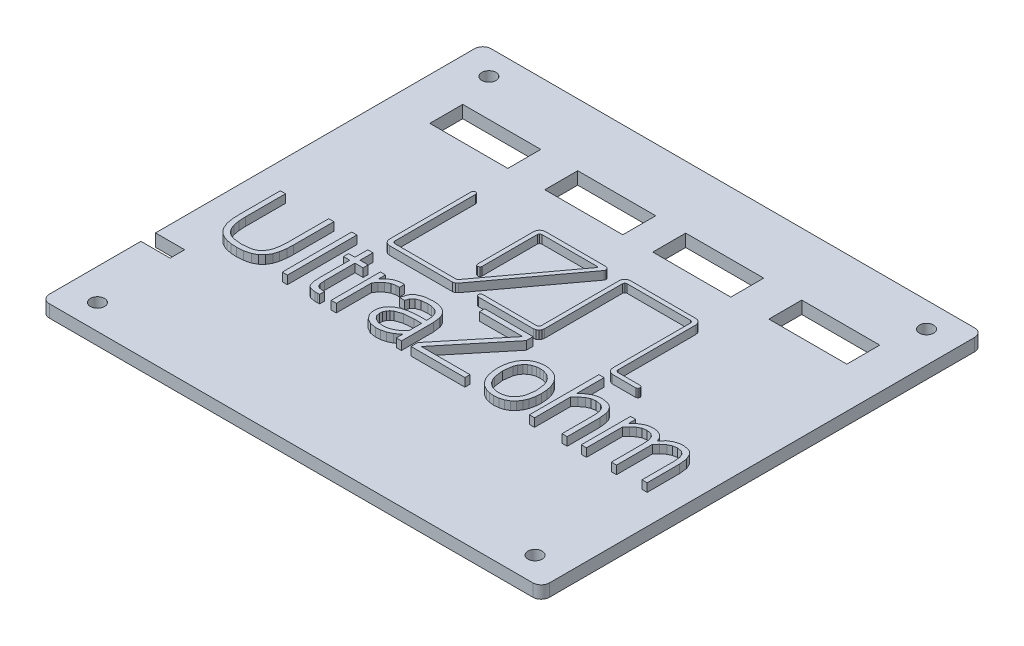
from build123d import *

# Parameters (mm, degrees)
AUFSATZ_LINEAR_AUSTRAGEN1_DEPTH = 3
SKIZZE2_R                       = 1.7
SCHNITT_LINEAR_AUSTRAGEN1_DEPTH = 3
SKIZZE3_W                       = 18.72
SKIZZE3_H                       = 7.9
SCHNITT_LINEAR_AUSTRAGEN2_DEPTH = 3
LINEARES_MUSTER1_COUNT          = 2
LINEARES_MUSTER1_PITCH          = 27.85
LINEARES_MUSTER2_COUNT          = 2
LINEARES_MUSTER2_PITCH          = 53.76
LINEARES_MUSTER3_COUNT          = 2
LINEARES_MUSTER3_PITCH          = 81.35
SKIZZE4_W                       = 7
SKIZZE4_H                       = 3.5
SCHNITT_LINEAR_AUSTRAGEN3_DEPTH = 3
SKIZZE9_W                       = 1.236063568
SKIZZE9_H                       = 16.679437304
AUFSATZ_LINEAR_AUSTRAGEN2_DEPTH = 2


with BuildPart() as part:
    # Skizze1 → Aufsatz-Linear austragen1 (new body)
    with BuildSketch(Plane(origin=(0, 0, 0), x_dir=(1, 0, 0), z_dir=(0, 1, 0))):
        with BuildLine():
            Line((-58, -53), (58, -53))
            ThreePointArc((58, -53), (59.414213562, -52.414213562), (60, -51))
            Line((60, -51), (60, 51))
            ThreePointArc((60, 51), (59.414213562, 52.414213562), (58, 53))
            Line((58, 53), (-58, 53))
            ThreePointArc((-58, 53), (-59.414213562, 52.414213562), (-60, 51))
            Line((-60, 51), (-60, -51))
            ThreePointArc((-60, -51), (-59.414213562, -52.414213562), (-58, -53))
        make_face()
    extrude(amount=AUFSATZ_LINEAR_AUSTRAGEN1_DEPTH)

    # Skizze2 → Schnitt-Linear austragen1 (cut)
    with BuildSketch(Plane(origin=(0, 3, 0), x_dir=(1, 0, 0), z_dir=(0, 1, 0))):
        with Locations(Location((-52.5, 46.97, 0), (0, 0, 270))):
            Circle(SKIZZE2_R)
        with Locations(Location((52.5, 46.97, 0), (0, 0, 270))):
            Circle(SKIZZE2_R)
        with Locations(Location((52.5, -46.97, 0), (0, 0, 270))):
            Circle(SKIZZE2_R)
        with Locations(Location((-52.5, -46.97, 0), (0, 0, 270))):
            Circle(SKIZZE2_R)
    extrude(amount=-SCHNITT_LINEAR_AUSTRAGEN1_DEPTH, mode=Mode.SUBTRACT)

    # Skizze3 → Schnitt-Linear austragen2 (cut)
    with BuildSketch(Plane(origin=(0, 3, 0), x_dir=(1, 0, 0), z_dir=(0, 1, 0))):
        with Locations((40.86, 34.08)):
            Rectangle(SKIZZE3_W, SKIZZE3_H)
    schnitt_linear_austragen2 = extrude(amount=-SCHNITT_LINEAR_AUSTRAGEN2_DEPTH, mode=Mode.SUBTRACT)

    # Lineares Muster1: Schnitt-Linear austragen2 ×2
    with Locations(*[(-i * LINEARES_MUSTER1_PITCH, 0, 0) for i in range(1, LINEARES_MUSTER1_COUNT)]):
        add(schnitt_linear_austragen2, mode=Mode.SUBTRACT)

    # Lineares Muster2: Schnitt-Linear austragen2 ×2
    with Locations(*[(-i * LINEARES_MUSTER2_PITCH, 0, 0) for i in range(1, LINEARES_MUSTER2_COUNT)]):
        add(schnitt_linear_austragen2, mode=Mode.SUBTRACT)

    # Lineares Muster3: Schnitt-Linear austragen2 ×2
    with Locations(*[(-i * LINEARES_MUSTER3_PITCH, 0, 0) for i in range(1, LINEARES_MUSTER3_COUNT)]):
        add(schnitt_linear_austragen2, mode=Mode.SUBTRACT)

    # Skizze4 → Schnitt-Linear austragen3 (cut)
    with BuildSketch(Plane(origin=(0, 3, 0), x_dir=(1, 0, 0), z_dir=(0, 1, 0))):
        with Locations((-56.5, -27.3)):
            Rectangle(SKIZZE4_W, SKIZZE4_H)
    extrude(amount=-SCHNITT_LINEAR_AUSTRAGEN3_DEPTH, mode=Mode.SUBTRACT)

    # Skizze9 → Aufsatz-Linear austragen2 (add)
    # profile 1 of 11: a face of its own
    with BuildSketch(Plane(origin=(0, 3, 0), x_dir=(1, 0, 0), z_dir=(0, 1, 0))):
        Polygon((-12.148241554, -2.128756598), (-27.28013001, -2.128756598), (-27.810505378, -2.020807614), (-28.243459554, -1.728197582), (-28.535284218, -1.294713054), (-28.64227105, -0.764142614), (-28.64227105, 18.884317962), (-28.49021649, 19.251409938), (-28.123124514, 19.403464498), (-27.75762969, 19.25053821), (-27.606450922, 18.884317962), (-27.606450922, -0.561428262), (-27.454248026, -0.927649526), (-27.087304386, -1.07810287), (-12.148241554, -1.07810287), (-12.039473674, -1.02123735), (2.190088926, 18.261346386), (2.202390654, 18.404853338), (2.078845054, 18.478894338), (-11.337387194, 18.478894338), (-11.704482218, 18.326840794), (-11.856537794, 17.959747802), (-11.856537794, 4.639930906), (-12.006989106, 4.272990314), (-12.373204274, 4.12078437), (-12.740299298, 4.272837914), (-12.892354874, 4.639930906), (-12.892354874, 18.142684698), (-12.785311146, 18.672890394), (-12.493394026, 19.105861842), (-12.060423594, 19.397780994), (-11.530217898, 19.504825738), (3.055331798, 19.504825738), (3.426465422, 19.41852365), (3.688681814, 19.142061922), (3.755248102, 18.76688665), (3.604148582, 18.417091058), (-11.211305658, -1.634326294), (-11.624119666, -1.987003262), align=None)
    # profile 2 of 11: a face of its own
    with BuildSketch(Plane(origin=(0, 3, 0), x_dir=(1, 0, 0), z_dir=(0, 1, 0))):
        Polygon((31.82841319, -2.128756598), (26.28096175, -2.128756598), (25.750586382, -2.020807614), (25.317632206, -1.728197582), (25.025807542, -1.294713054), (24.91882071, -0.764142614), (24.91882071, 17.952325922), (24.767640926, 18.318547186), (24.40214407, 18.471472458), (9.10957623, 18.471472458), (8.744079374, 18.318547186), (8.59289959, 17.952325922), (8.59289959, -0.751781958), (8.493061334, -1.276651622), (8.199350974, -1.722959086), (7.75679255, -2.022288942), (7.23322743, -2.128756598), (-5.960509962, -2.128756598), (-6.327604986, -1.976703054), (-6.479660562, -1.609610062), (-6.327604986, -1.24251707), (-5.960509962, -1.090463526), (7.03793191, -1.090463526), (7.404867422, -0.940006118), (7.55706727, -0.573788918), (7.55706727, 18.142679618), (7.66075515, 18.66395061), (7.956033198, 19.105861842), (8.397946462, 19.401136842), (8.91921847, 19.504820658), (24.59249167, 19.504820658), (25.113763678, 19.401136842), (25.555676942, 19.105861842), (25.85095499, 18.66395061), (25.95464287, 18.142679618), (25.95464287, -0.56390019), (26.106845766, -0.930120438), (26.47378839, -1.080574798), (31.82841319, -1.080574798), (32.193902934, -1.233503118), (32.34507967, -1.599721334), (32.197435566, -1.97234035), align=None)
    # profile 3 of 11: a face of its own
    with BuildSketch(Plane(origin=(0, 3, 0), x_dir=(1, 0, 0), z_dir=(0, 1, 0))):
        Polygon((-45.35384545, -20.793310582), (-46.65029701, -20.727910662), (-47.924857834, -20.481822254), (-48.850712218, -20.139625326), (-49.699843362, -19.636354806), (-50.322953114, -19.06881111), (-50.81971717, -18.387931598), (-51.45010961, -16.86510203), (-51.719571098, -15.188999718), (-51.773957578, -13.498065838), (-51.773957578, -3.80980175), (-50.537895026, -3.80980175), (-50.537895026, -13.451095142), (-50.470829882, -15.012951302), (-50.191796658, -16.551141774), (-49.803140082, -17.54851951), (-49.178224898, -18.417596766), (-48.426548474, -18.986950974), (-47.549093282, -19.332283278), (-45.346429666, -19.579496398), (-43.12151565, -19.332283278), (-42.240871234, -18.987977134), (-41.49238505, -18.410180982), (-40.88297809, -17.537869798), (-40.503533586, -16.543724974), (-40.231458946, -15.00871255), (-40.167324962, -13.451095142), (-40.167324962, -3.80980175), (-38.931261394, -3.80980175), (-38.931261394, -13.500537766), (-38.995664618, -15.045926598), (-39.222972266, -16.575863086), (-39.600068794, -17.780227454), (-40.236544026, -18.869996166), (-41.12466417, -19.72009759), (-42.209301066, -20.298885358), (-43.758540538, -20.692588406), align=None)
    # profile 4 of 11: a face of its own
    with BuildSketch(Plane(origin=(0, 3, 0), x_dir=(1, 0, 0), z_dir=(0, 1, 0))):
        with Locations((-34.021618178, -12.149520402)):
            Rectangle(SKIZZE9_W, SKIZZE9_H)
    # profile 5 of 11: a face of its own
    with BuildSketch(Plane(origin=(0, 3, 0), x_dir=(1, 0, 0), z_dir=(0, 1, 0))):
        Polygon((-25.53975249, -20.595540086), (-26.06137197, -20.642509766), (-26.582990434, -20.657343366), (-27.866023682, -20.434852574), (-28.291326362, -20.16457727), (-28.60766101, -19.772322022), (-28.938926794, -18.669753742), (-29.015563674, -17.122202862), (-29.015563674, -9.903592966), (-30.535921314, -9.903592966), (-30.535921314, -8.684835942), (-29.015563674, -8.684835942), (-29.015563674, -5.589733166), (-27.779500106, -5.589733166), (-27.779500106, -8.682362998), (-25.828993466, -8.682362998), (-25.828993466, -9.901122054), (-27.779500106, -9.901122054), (-27.779500106, -17.226031966), (-27.670727146, -18.392875454), (-27.34935009, -19.06282179), (-26.820315842, -19.366893318), (-26.105870738, -19.436113398), (-25.814159866, -19.436113398), (-25.537282594, -19.421279798), align=None)
    # profile 6 of 11: a face of its own
    with BuildSketch(Plane(origin=(0, 3, 0), x_dir=(1, 0, 0), z_dir=(0, 1, 0))):
        Polygon((-17.413874914, -9.629187622), (-17.782222666, -9.599520422), (-18.229675162, -9.599520422), (-19.245719866, -9.812123502), (-20.182655762, -10.36835099), (-21.010817682, -11.144599374), (-21.67087529, -12.034564574), (-21.67087529, -20.489239054), (-22.906938858, -20.489239054), (-22.906938858, -8.684835942), (-21.67087529, -8.684835942), (-21.67087529, -10.313966542), (-20.635054146, -9.325116094), (-19.646203698, -8.729333694), (-18.716683586, -8.44751155), (-17.903351202, -8.38076035), (-17.673445642, -8.38076035), (-17.426236586, -8.40301075), align=None)
    # profile 7 of 11: a face of its own
    with BuildSketch(Plane(origin=(0, 3, 0), x_dir=(1, 0, 0), z_dir=(0, 1, 0))):
        Polygon((-7.278154266, -18.96640847), (-8.514219866, -19.87120727), (-9.688479138, -20.434851558), (-10.833073242, -20.716674718), (-11.985085162, -20.793311598), (-13.443638506, -20.558459134), (-14.610478946, -19.888512798), (-15.386725298, -18.835387142), (-15.603838402, -18.169962006), (-15.671028514, -17.473246102), (-15.568948962, -16.529328254), (-15.228323786, -15.660205278), (-14.673336834, -14.909612926), (-13.928171954, -14.321284918), (-12.947665914, -13.828096166), (-11.74899521, -13.47581747), (-10.33215781, -13.264450862), (-8.697155746, -13.193995326), (-7.285572082, -13.193995326), (-7.37704561, -11.762632174), (-7.807190546, -10.627926798), (-8.247109402, -10.17944611), (-8.796037946, -9.873927798), (-9.681512426, -9.650647574), (-10.593272858, -9.599522454), (-12.056159442, -9.728690598), (-13.10249009, -10.116196046), (-13.779784138, -10.785902606), (-14.09133749, -11.68599631), (-15.30514761, -11.68599631), (-14.882413378, -10.224970022), (-14.493055762, -9.655762118), (-13.985036458, -9.194092734), (-12.572832018, -8.582860022), (-10.60563453, -8.380763398), (-9.53733593, -8.444612902), (-8.494440378, -8.684835942), (-7.735111442, -9.037889846), (-7.080389866, -9.559968558), (-6.601830498, -10.206046006), (-6.289306866, -10.94683091), (-6.042096794, -12.781148806), (-6.042096794, -20.489239054), (-7.278154266, -20.489239054), align=None)
        Polygon((-7.278154266, -14.41275235), (-9.134719514, -14.41275235), (-11.469024218, -14.603106046), (-13.122260434, -15.174167134), (-13.675180842, -15.56016179), (-14.091848538, -16.074343134), (-14.351896786, -16.682922054), (-14.434961898, -17.352110454), (-14.231470306, -18.277896766), (-13.60432805, -18.988657854), (-12.622276674, -19.428077854), (-11.332444354, -19.574551526), (-10.111215402, -19.384198846), (-8.996287482, -18.889772606), (-8.037096106, -18.212410486), (-7.278154266, -17.48807767), align=None, mode=Mode.SUBTRACT)
    # profile 8 of 11: a face of its own
    with BuildSketch(Plane(origin=(0, 3, 0), x_dir=(1, 0, 0), z_dir=(0, 1, 0))):
        Polygon((9.18620295, -20.489239054), (-3.747957618, -20.489239054), (-3.747957618, -18.874940022), (7.60403695, -5.031032734), (-2.749224538, -5.031032734), (-2.749224538, -3.80980175), (8.86976975, -3.80980175), (8.86976975, -5.441405294), (-2.502005322, -19.270479998), (9.18620295, -19.270479998), align=None)
    # profile 9 of 11: a face of its own
    with BuildSketch(Plane(origin=(0, 3, 0), x_dir=(1, 0, 0), z_dir=(0, 1, 0))):
        Polygon((16.38009255, -8.380763398), (17.501681366, -8.480258246), (18.58028119, -8.80349763), (19.487592558, -9.316066582), (20.25390751, -10.02225567), (20.887919958, -10.940682078), (21.32434479, -11.96781947), (21.605241358, -13.265518678), (21.698873886, -14.583329606), (21.605241358, -15.901139518), (21.32434479, -17.198838726), (20.889885918, -18.231284718), (20.25886559, -19.156763182), (19.490792958, -19.86238331), (18.58276023, -20.375521222), (17.509148966, -20.685806606), (16.40605135, -20.789235406), (15.302953734, -20.685806606), (14.22934247, -20.375521222), (13.325175622, -19.867596406), (12.56313295, -19.164178966), (11.927959214, -18.238760446), (11.48775791, -17.20625451), (11.203126526, -15.90134983), (11.108248382, -14.575912806), (11.203126526, -13.250474766), (11.48775791, -11.945570086), (11.922815206, -10.919654942), (12.55571615, -10.00247923), (13.322884542, -9.300584774), (14.22934247, -8.791135958), (15.284100838, -8.47790011), align=None)
        Polygon((16.38009255, -19.574551526), (17.221354774, -19.501349742), (18.03147863, -19.263064214), (18.729738854, -18.867980422), (19.31451391, -18.318711518), (19.811521806, -17.575977926), (20.15009263, -16.748911254), (20.451691214, -14.570967934), (20.15009263, -12.39302563), (19.812462622, -11.573634838), (19.31451391, -10.840528862), (18.727420342, -10.300646782), (18.03147863, -9.911009766), (17.213042878, -9.677438478), (16.37268083, -9.599581382), (15.532318782, -9.677438478), (14.71388303, -9.911009766), (14.017941318, -10.300646782), (13.43084775, -10.840528862), (12.935145414, -11.573237582), (12.60268583, -12.39302563), (12.310991214, -14.570967934), (12.60268583, -16.748911254), (12.936244726, -17.576290854), (13.43084775, -18.318711518), (14.015622806, -18.867980422), (14.71388303, -19.263064214), (15.531428766, -19.502036558), align=None, mode=Mode.SUBTRACT)
    # profile 10 of 11: a face of its own
    with BuildSketch(Plane(origin=(0, 3, 0), x_dir=(1, 0, 0), z_dir=(0, 1, 0))):
        Polygon((25.90519415, -10.437572086), (27.04732039, -9.369613846), (28.13999791, -8.746638206), (29.15356967, -8.457400278), (30.06578527, -8.380763398), (31.671897374, -8.649143862), (32.30286995, -8.984618934), (32.81911987, -9.454284238), (33.22064815, -10.058139774), (33.507453774, -10.796185542), (33.73689807, -12.674847774), (33.73689807, -20.489239054), (32.50083247, -20.489239054), (32.50083247, -12.781148806), (32.35497551, -11.35720347), (31.88033079, -10.368353022), (31.02003279, -9.78987615), (29.72216391, -9.599522454), (28.707263222, -9.75420439), (27.77906391, -10.192832926), (26.779432686, -10.964674918), (25.89777735, -11.868934222), (25.89777735, -20.489239054), (24.66171175, -20.489239054), (24.66171175, -3.809800734), (25.89777735, -3.809800734), align=None)
    # profile 11 of 11: a face of its own
    with BuildSketch(Plane(origin=(0, 3, 0), x_dir=(1, 0, 0), z_dir=(0, 1, 0))):
        Polygon((52.91812463, -20.489239054), (51.68205903, -20.489239054), (51.68205903, -12.781148806), (51.549798182, -11.326920574), (51.15301767, -10.346104654), (50.416330294, -9.78987615), (49.28656471, -9.60446631), (48.285716318, -9.764246534), (47.37314207, -10.205192566), (46.402473958, -10.981747782), (45.56849239, -11.903544262), (45.56849239, -20.49418291), (44.33242679, -20.49418291), (44.33242679, -12.781148806), (44.21870591, -11.334955102), (43.82563583, -10.346104654), (43.08399647, -9.782460366), (41.97154759, -9.599522454), (41.00304559, -9.757438318), (40.12734503, -10.20024871), (39.184195278, -10.986445766), (38.36223807, -11.89859939), (38.36223807, -20.489239054), (37.12618263, -20.489239054), (37.12618263, -8.684835942), (38.36223807, -8.684835942), (38.36223807, -10.437572086), (39.52166679, -9.347365478), (40.55008231, -8.729333694), (41.47217343, -8.44751155), (42.30775215, -8.38076035), (43.33613719, -8.499415942), (44.28545711, -8.912267542), (45.018263366, -9.625931342), (45.46960511, -10.543871086), (46.44362399, -9.483329646), (47.48933183, -8.820799094), (48.55729007, -8.479645598), (49.60052903, -8.380758318), (51.046412854, -8.649138782), (51.614305038, -8.984613854), (52.07883243, -9.454279158), (52.697788774, -10.796180462), (52.90328087, -12.674842694), align=None)
    extrude(amount=AUFSATZ_LINEAR_AUSTRAGEN2_DEPTH)


solid = part.part
